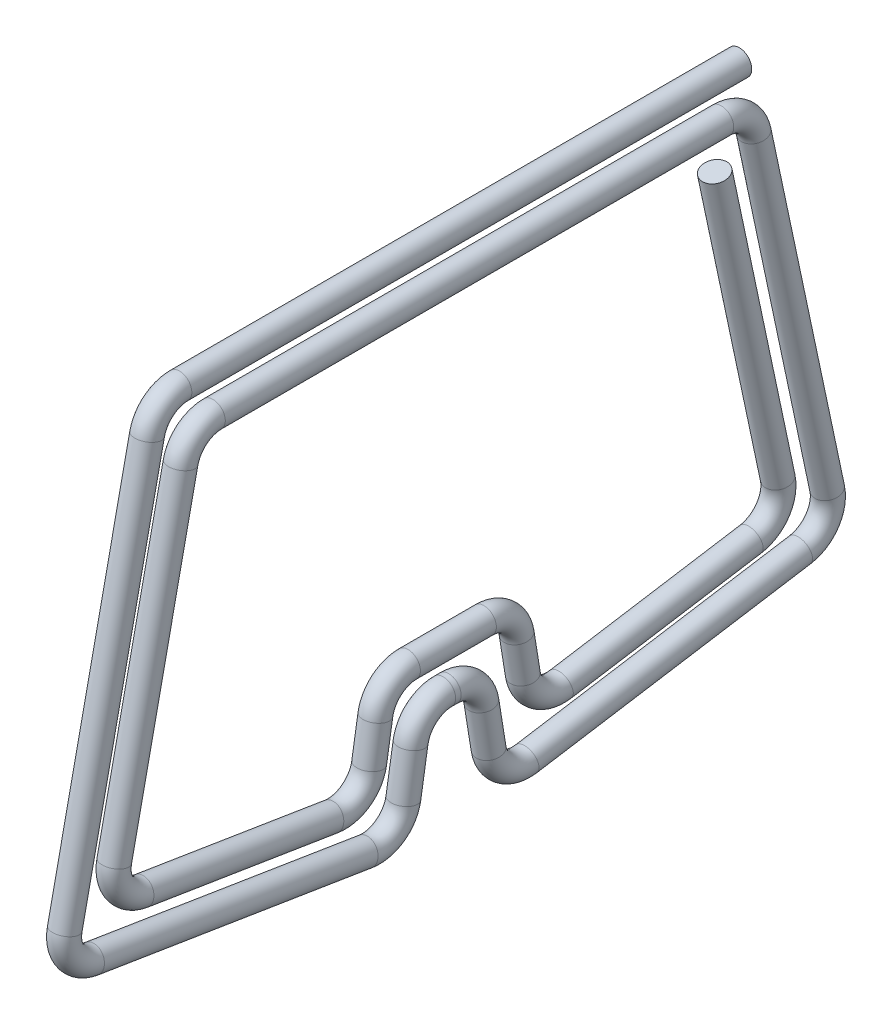
from build123d import *

# Parameters (mm, degrees)
SKETCH_3_R = 1.5


with BuildPart() as part:
    # По траектории1: sweep along a path in Эскиз2
    with BuildLine(Plane(origin=(0, 0, 0), x_dir=(0, 0, -1), z_dir=(1, 0, 0))) as sweep_1_path:
        Line((35.483874891, 5), (-32.244738758, 5))
        ThreePointArc((-32.244738758, 5), (-34.762020322, 4.108583846), (-36.157329161, 1.831646763))
        Line((-36.157329161, 1.831646763), (-46.109286654, -44.988632107))
        ThreePointArc((-46.109286654, -44.988632107), (-45.496013892, -48.081805589), (-42.832251164, -49.769464856))
        Line((-42.832251164, -49.769464856), (-9.73834486, -55.095371211))
        ThreePointArc((-9.73834486, -55.095371211), (-6.759698945, -54.388086604), (-5.153603961, -51.781740138))
        Line((-5.153603961, -51.781740138), (-4.281781642, -46.364445087))
        ThreePointArc((-4.281781642, -46.364445087), (-2.926606098, -43.955150279), (-0.332595656, -43))
        Line((-0.332595656, -43), (0.332595656, -43))
        ThreePointArc((0.332595656, -43), (2.926606098, -43.955150279), (4.281781642, -46.364445087))
        Line((4.281781642, -46.364445087), (5.153603961, -51.781740138))
        ThreePointArc((5.153603961, -51.781740138), (6.759698945, -54.388086604), (9.73834486, -55.095371211))
        Line((9.73834486, -55.095371211), (42.832251164, -49.769464856))
        ThreePointArc((42.832251164, -49.769464856), (45.496013892, -48.081805589), (46.109286654, -44.988632107))
        Line((46.109286654, -44.988632107), (37.220111969, -3.168353237))
        ThreePointArc((37.220111969, -3.168353237), (35.824803131, -0.891416154), (33.307521566, 0))
        Line((33.307521566, 0), (-28.195818592, 0))
        ThreePointArc((-28.195818592, 0), (-30.713100156, -0.891416154), (-32.108408995, -3.168353237))
        Line((-32.108408995, -3.168353237), (-40.125805399, -40.887237756))
        ThreePointArc((-40.125805399, -40.887237756), (-39.512532637, -43.980411239), (-36.848769909, -45.668070506))
        Line((-36.848769909, -45.668070506), (-13.880383702, -49.364445087))
        ThreePointArc((-13.880383702, -49.364445087), (-10.901737787, -48.657160481), (-9.295642803, -46.050814014))
        Line((-9.295642803, -46.050814014), (-8.541450722, -41.364445087))
        ThreePointArc((-8.541450722, -41.364445087), (-7.186275178, -38.955150279), (-4.592264736, -38))
        Line((-4.592264736, -38), (4.592264736, -38))
        ThreePointArc((4.592264736, -38), (7.186275178, -38.955150279), (8.541450722, -41.364445087))
        Line((8.541450722, -41.364445087), (9.295642803, -46.050814014))
        ThreePointArc((9.295642803, -46.050814014), (10.901737787, -48.657160481), (13.880383702, -49.364445087))
        Line((13.880383702, -49.364445087), (36.848769909, -45.668070506))
        ThreePointArc((36.848769909, -45.668070506), (39.512532637, -43.980411239), (40.125805399, -40.887237756))
        Line((40.125805399, -40.887237756), (32.497737533, -5))
    # Эскиз3 → По траектории1 (sweep)
    with BuildSketch(Plane(origin=(0, 5, -35.483874891), x_dir=(-1, 0, 0), z_dir=(0, 0, -1))):
        Circle(SKETCH_3_R)
    sweep(path=sweep_1_path.line)


solid = part.part
